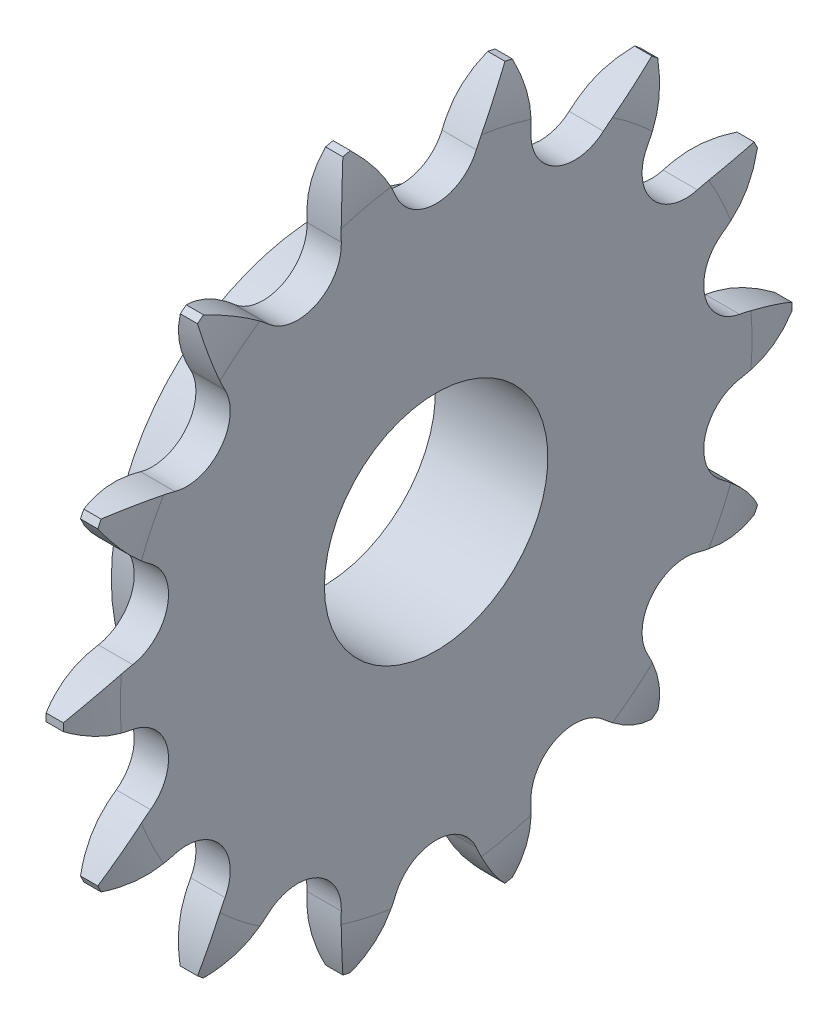
from build123d import *

# Parameters (mm, degrees)
TOOTHCUT_DEPTH     = 47.204185403
TEETHCUTS_COUNT    = 14
TEETHCUTS_ANGLE    = 334.285714286
HUBNEAONESKE_R     = 19
HUBNEARONE_DEPTH   = 7
HUBNEARONEFILLET_R = 0.6
BORE_DEPTH         = 47.114209564
BORE_DEPTH_BACK    = 47.114209564
BORSKE_R           = 10


with BuildPart() as part:
    # BasProSke → Base-Revolve (revolve)
    with BuildSketch(Plane(origin=(0, 0, 0), x_dir=(1, 0, 0), z_dir=(0, 1, 0)), mode=Mode.PRIVATE) as base_revolve_sk:
        with BuildLine():
            Line((0, 0), (0, 28.266225584))
            ThreePointArc((0, 28.266225584), (0.191950592, 30.465930109), (0.762, 32.599140999))
            Line((0.762, 32.599140999), (2.307, 32.599140999))
            ThreePointArc((2.307, 32.599140999), (2.877049408, 30.465930109), (3.069, 28.266225584))
            Line((3.069, 28.266225584), (3.069, 0))
            Line((3.069, 0), (0, 0))
        make_face()
    revolve(base_revolve_sk.sketch.rotate(Axis((-10, 0, 0), (1, 0, 0)), 180), axis=Axis((-10, 0, 0), (1, 0, 0)))

    # TooCutSke → ToothCut (cut, through all)
    with BuildSketch(Plane(origin=(0, 0, 0), x_dir=(0, 0, -1), z_dir=(1, 0, 0))):
        with BuildLine():
            ThreePointArc((3.596881403, 27.032703982), (5.193512578, 29.857711154), (7.364572687, 32.269431418))
            ThreePointArc((7.364572687, 32.269431418), (0, 33.099140999), (-7.364572687, 32.269431418))
            ThreePointArc((-7.364572687, 32.269431418), (-5.193512578, 29.857711154), (-3.596881403, 27.032703982))
            ThreePointArc((-3.596881403, 27.032703982), (0, 24.661640999), (3.596881403, 27.032703982))
        make_face()
    toothcut = extrude(amount=TOOTHCUT_DEPTH, mode=Mode.SUBTRACT)

    # TeethCuts: ToothCut ×14 about axis
    teethcuts_axis = Axis((-10, 0, 0), (1, 0, 0))
    for i in range(1, TEETHCUTS_COUNT):
        add(toothcut.rotate(teethcuts_axis, i * TEETHCUTS_ANGLE / (TEETHCUTS_COUNT - 1)), mode=Mode.SUBTRACT)

    # HubNeaOneSke → HubNearOne (add)
    with BuildSketch(Plane.ZY):
        with Locations(Location((0, 0, 0), (0, 0, 180))):
            Circle(HUBNEAONESKE_R)
    extrude(amount=HUBNEARONE_DEPTH)

    # HubNearOneFillet
    hubnearonefillet_edges = [part.edges().sort_by_distance(p)[0] for p in [
        (0, 0, 19),
    ]]
    fillet(hubnearonefillet_edges, radius=HUBNEARONEFILLET_R)

    # BorSke → Bore (cut, two sides: drawn at the far end of the back side and taken through both)
    with BuildSketch(Plane(origin=(0, 0, 0), x_dir=(0, 0, -1), z_dir=(1, 0, 0)).offset(-BORE_DEPTH_BACK)):
        with Locations(Location((0, 0, 0), (0, 0, 180))):
            Circle(BORSKE_R)
    extrude(amount=BORE_DEPTH + BORE_DEPTH_BACK, mode=Mode.SUBTRACT)


solid = part.part
